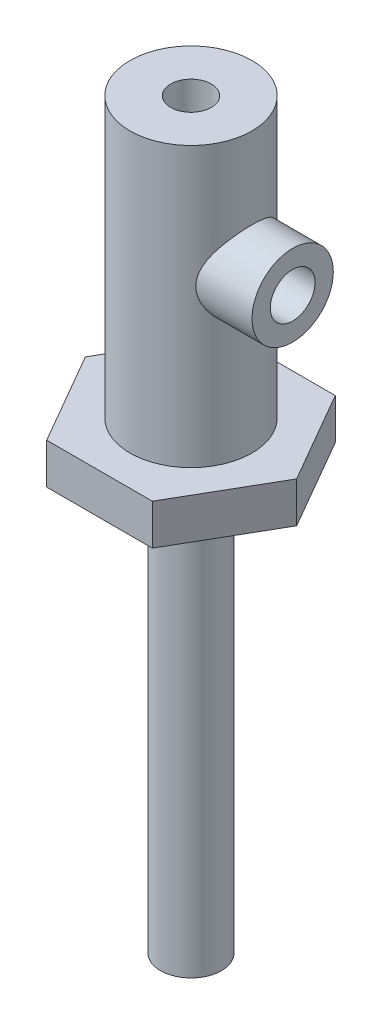
from build123d import *

# Parameters (mm, degrees)
SKETCH1_R                = 3
BOSS_EXTRUDE1_DEPTH      = 15.725
SKETCH2_R                = 1
CUT_EXTRUDE3_DEPTH       = 10.2
BOSS_EXTRUDE2_DEPTH      = 2
SKETCH4_R                = 1.5
BOSS_EXTRUDE3_DEPTH      = 20.8
BOSS_EXTRUDE4_DEPTH      = 2
BOSS_EXTRUDE4_DEPTH_BACK = 1
SKETCH6_R                = 2
SKETCH6_R_2              = 1.1
SKETCH7_R                = 1.1
CUT_EXTRUDE4_DEPTH       = 3


with BuildPart() as part:
    # Sketch1 → Boss-Extrude1 (new body)
    with BuildSketch(Plane(origin=(0, 0, 0), x_dir=(1, 0, 0), z_dir=(0, 1, 0))):
        with Locations(Location((0, 0, 0), (0, 0, 270))):
            Circle(SKETCH1_R)
    extrude(amount=BOSS_EXTRUDE1_DEPTH)

    # Sketch2 → Cut-Extrude3 (cut)
    with BuildSketch(Plane(origin=(0, 15.725, 0), x_dir=(1, 0, 0), z_dir=(0, 1, 0))):
        with Locations(Location((0, 0, 0), (0, 0, 270))):
            Circle(SKETCH2_R)
    extrude(amount=-CUT_EXTRUDE3_DEPTH, mode=Mode.SUBTRACT)

    # Sketch3 → Boss-Extrude2 (add)
    with BuildSketch(Plane(origin=(0, 0, 0), x_dir=(-1, 0, 0), z_dir=(0, -1, 0))):
        Polygon((5.196152423, 0), (2.598076211, 4.5), (-2.598076211, 4.5), (-5.196152423, 0), (-2.598076211, -4.5), (2.598076211, -4.5), align=None)
    extrude(amount=-BOSS_EXTRUDE2_DEPTH)

    # Sketch4 → Boss-Extrude3 (add)
    with BuildSketch(Plane(origin=(0, 0, 0), x_dir=(-1, 0, 0), z_dir=(0, -1, 0))):
        with Locations(Location((0, 0, 0), (0, 0, 90))):
            Circle(SKETCH4_R)
    extrude(amount=BOSS_EXTRUDE3_DEPTH)

    # Sketch6 → Boss-Extrude4 (add, two sides: drawn at the far end of the back side and taken through both)
    with BuildSketch(Plane(origin=(3, 0, 0), x_dir=(0, 0, -1), z_dir=(1, 0, 0)).offset(-BOSS_EXTRUDE4_DEPTH_BACK)):
        with Locations((0, 9.725)):
            Circle(SKETCH6_R)
        with Locations((0, 9.725)):
            Circle(SKETCH6_R_2, mode=Mode.SUBTRACT)
    extrude(amount=BOSS_EXTRUDE4_DEPTH + BOSS_EXTRUDE4_DEPTH_BACK)

    # Sketch7 → Cut-Extrude4 (cut)
    with BuildSketch(Plane(origin=(3, 0, 0), x_dir=(0, 0, -1), z_dir=(1, 0, 0))):
        with Locations((0, 9.725)):
            Circle(SKETCH7_R)
    extrude(amount=-CUT_EXTRUDE4_DEPTH, mode=Mode.SUBTRACT)


solid = part.part
